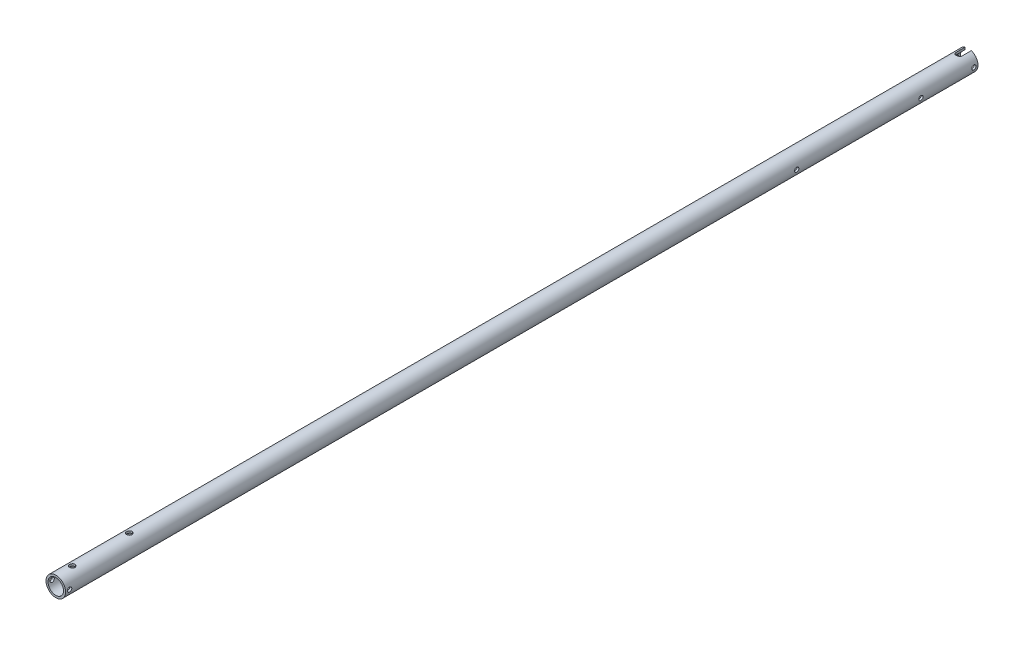
from build123d import *

# Parameters (mm, degrees)
SKETCH1_R                = 15.24
SKETCH1_R_2              = 12.065
BOSS_EXTRUDE1_DEPTH      = 1422.4
F_5_16_CLEARANCE_HOLE1_D = 8.4328
F_1_4_CLEARANCE_HOLE3_D  = 6.7564
CUT_EXTRUDE1_DEPTH       = 1423.808155829


with BuildPart() as part:
    # Sketch1 → Boss-Extrude1 (new body)
    with BuildSketch(Plane.XY):
        Circle(SKETCH1_R)
        Circle(SKETCH1_R_2, mode=Mode.SUBTRACT)
    extrude(amount=BOSS_EXTRUDE1_DEPTH)

    # 5/16 Clearance Hole1 (through all)
    with Locations(Plane(origin=(0, -15.24, 0), x_dir=(-1, 0, 0), z_dir=(0, -1, 0))):
        with Locations((0, -1397), (0, -1308.1)):
            Hole(F_5_16_CLEARANCE_HOLE1_D / 2)

    # 1/4 Clearance Hole3 (through all)
    with Locations(Plane.ZY.offset(15.24)):
        with Locations((88.9, 0), (282.575, 0), (6.35, 0), (1416.05, 0)):
            Hole(F_1_4_CLEARANCE_HOLE3_D / 2)

    # Sketch12 → Cut-Extrude1 (cut, through all)
    with BuildSketch(Plane(origin=(0, -15.24, 0), x_dir=(-1, 0, 0), z_dir=(0, -1, 0))):
        with BuildLine():
            Line((0, 0), (4.7625, 0))
            Line((4.7625, 0), (4.7625, -14.2875))
            ThreePointArc((4.7625, -14.2875), (0, -19.05), (-4.7625, -14.2875))
            Line((-4.7625, -14.2875), (-4.7625, 0))
            Line((-4.7625, 0), (0, 0))
        make_face()
    extrude(amount=-CUT_EXTRUDE1_DEPTH, mode=Mode.SUBTRACT)


solid = part.part
